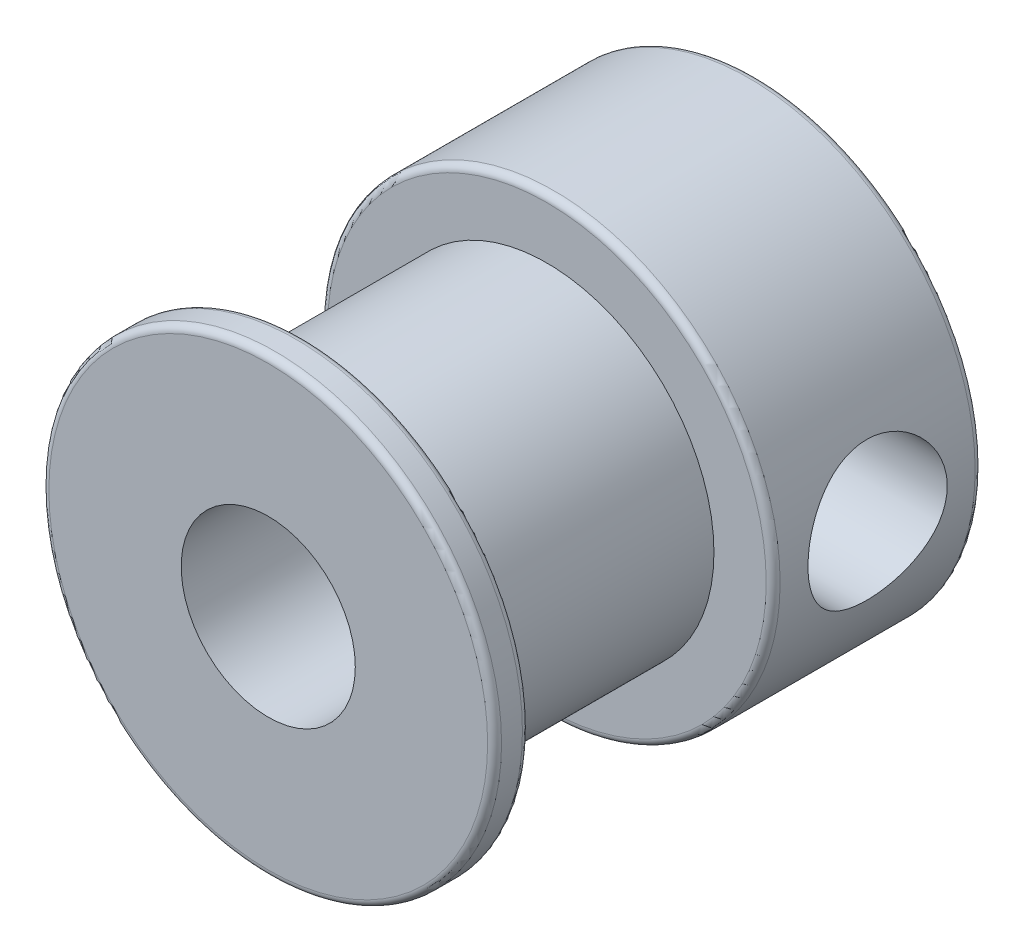
from build123d import *

# Parameters (mm, degrees)
SKETCH1_R           = 6.5
SKETCH1_R_2         = 2.5
BOSS_EXTRUDE1_DEPTH = 14
SKETCH2_W           = 7
SKETCH2_H           = 4.416086924
FILLET2_R           = 0.2
SKETCH4_R           = 2
CUT_EXTRUDE1_DEPTH  = 6


with BuildPart() as part:
    # Sketch1 → Boss-Extrude1 (new body)
    with BuildSketch(Plane.XY):
        Circle(SKETCH1_R)
        Circle(SKETCH1_R_2, mode=Mode.SUBTRACT)
    extrude(amount=BOSS_EXTRUDE1_DEPTH)

    # Sketch2 → Cut-Revolve1 (revolve, cut)
    with BuildSketch(Plane(origin=(0, 0, 0), x_dir=(0, 0, -1), z_dir=(1, 0, 0)), mode=Mode.PRIVATE) as cut_revolve1_sk:
        with Locations((-9.5, -7.008043462)):
            Rectangle(SKETCH2_W, SKETCH2_H)
    revolve(cut_revolve1_sk.sketch.rotate(Axis((0, 0, 15.643909914), (0, 0, -1)), 270), axis=Axis((0, 0, 15.643909914), (0, 0, -1)), mode=Mode.SUBTRACT)

    # Fillet2
    fillet2_edges = [part.edges().sort_by_distance(p)[0] for p in [
        (-6.5, 0, 13),
        (-6.5, 0, 6),
        (-6.5, 0, 0),
        (-6.5, 0, 14),
    ]]
    fillet(fillet2_edges, radius=FILLET2_R)

    # Sketch4 → Cut-Extrude1 (cut)
    with BuildSketch(Plane(origin=(6.5, 0, 0), x_dir=(0, 0, -1), z_dir=(1, 0, 0))):
        with Locations((-3, 0)):
            Circle(SKETCH4_R)
    extrude(amount=-CUT_EXTRUDE1_DEPTH, mode=Mode.SUBTRACT)


solid = part.part
